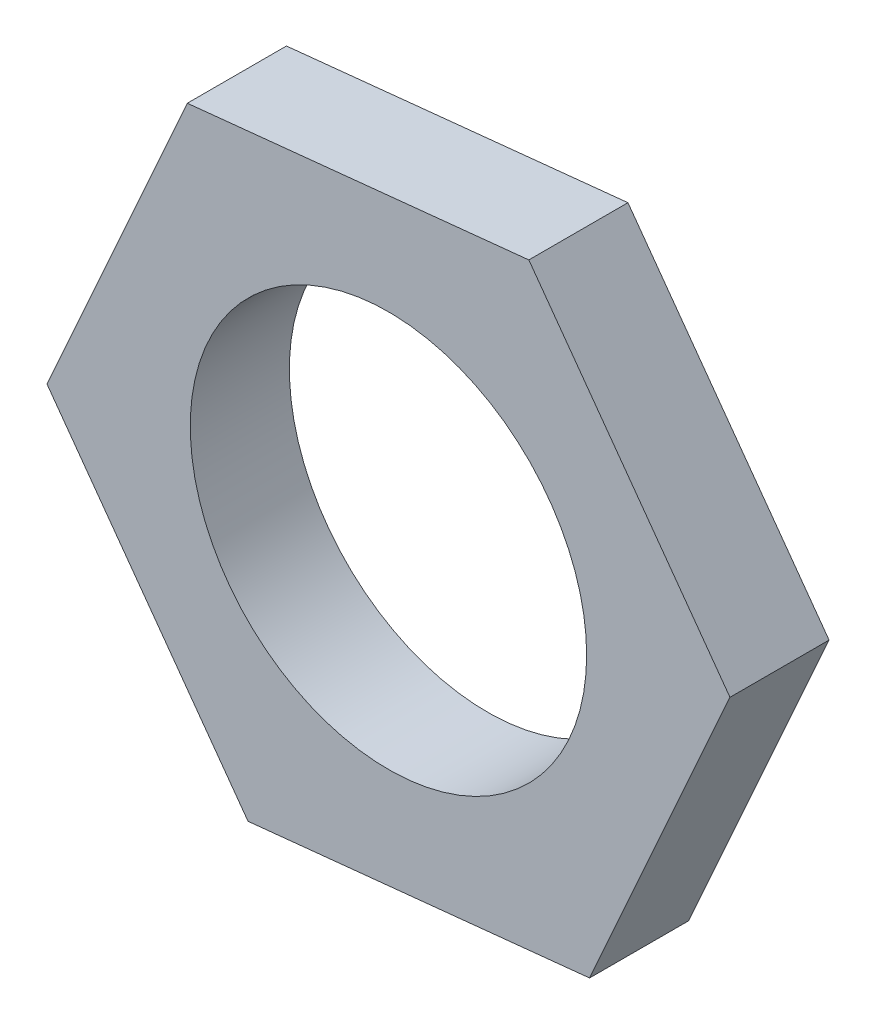
from build123d import *

# Parameters (mm, degrees)
SKETCH1_R           = 0.5
BOSS_EXTRUDE1_DEPTH = 0.25


with BuildPart() as part:
    # Sketch1 → Boss-Extrude1 (new body)
    with BuildSketch(Plane.XY):
        Polygon((0.507353094, -0.701849584), (0.861496116, 0.088455876), (0.354143022, 0.79030546), (-0.507353094, 0.701849584), (-0.861496116, -0.088455876), (-0.354143022, -0.79030546), align=None)
        Circle(SKETCH1_R, mode=Mode.SUBTRACT)
    extrude(amount=BOSS_EXTRUDE1_DEPTH)


solid = part.part
